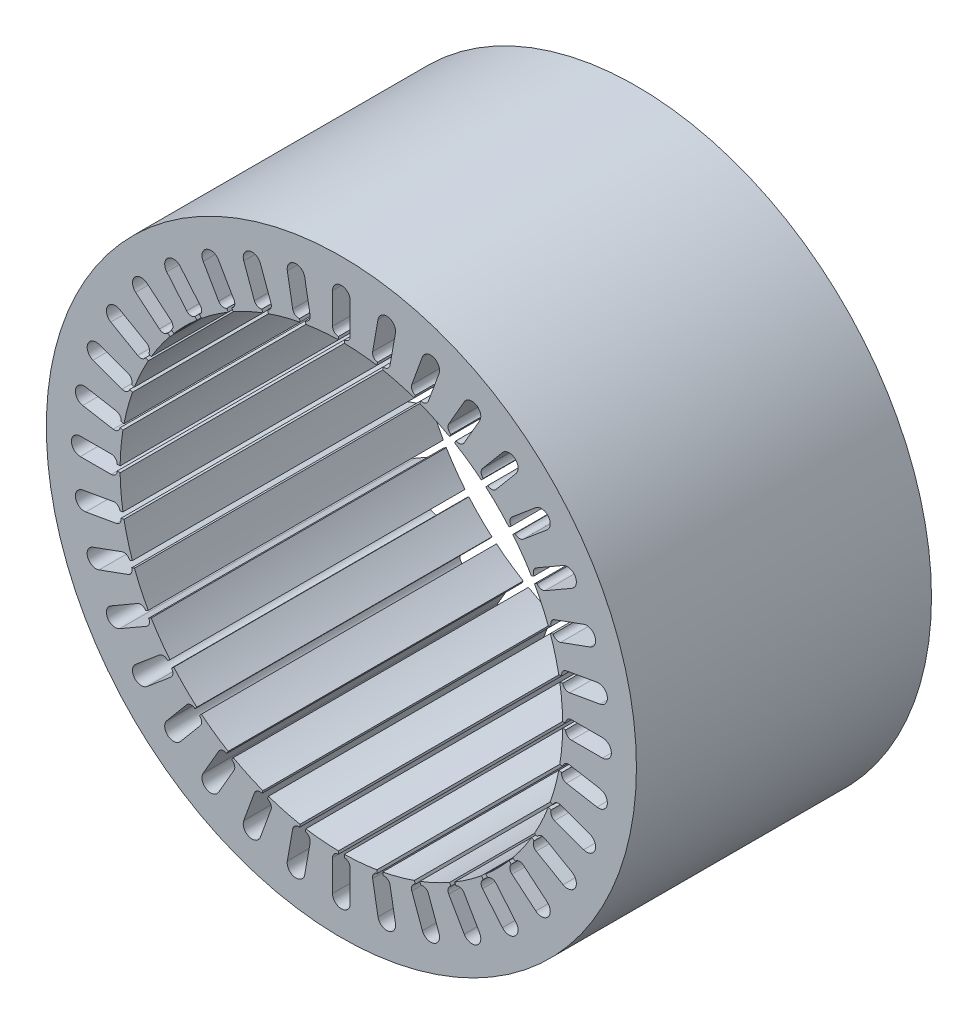
from build123d import *

# Parameters (mm, degrees)
SKETCH1_R           = 100
BOSS_EXTRUDE1_DEPTH = 100


with BuildPart() as part:
    # Sketch1 → Boss-Extrude1 (new body)
    with BuildSketch(Plane.XY):
        Circle(SKETCH1_R)
        with BuildLine():
            Line((74.027663977, -12.037647866), (75.01247173, -12.211296044))
            ThreePointArc((75.01247173, -12.211296044), (75.834934363, -10.92028831), (77.329383591, -10.588976893))
            Line((77.329383591, -10.588976893), (87.669864998, -12.412282759))
            ThreePointArc((87.669864998, -12.412282759), (90.103343724, -15.887650551), (86.627975932, -18.321129277))
            Line((86.627975932, -18.321129277), (76.287494525, -16.497823411))
            ThreePointArc((76.287494525, -16.497823411), (74.996486792, -15.675360778), (74.665175374, -14.18091155))
            Line((74.665175374, -14.18091155), (73.680367621, -14.007263372))
            ThreePointArc((73.680367621, -14.007263372), (73.112351072, -16.720769145), (72.444436972, -19.411428383))
            ThreePointArc((72.444436972, -19.411428383), (71.677537931, -22.075564686), (70.812701806, -24.709537893))
            Line((70.812701806, -24.709537893), (71.752394427, -25.051558036))
            ThreePointArc((71.752394427, -25.051558036), (72.786543145, -23.922982749), (74.315819955, -23.856213081))
            Line((74.315819955, -23.856213081), (84.182592474, -27.447424586))
            ThreePointArc((84.182592474, -27.447424586), (85.975609906, -31.292562879), (82.130471614, -33.085580311))
            Line((82.130471614, -33.085580311), (72.263699095, -29.494368806))
            ThreePointArc((72.263699095, -29.494368806), (71.135123808, -28.460220088), (71.06835414, -26.930943278))
            Line((71.06835414, -26.930943278), (70.12866152, -26.588923135))
            ThreePointArc((70.12866152, -26.588923135), (69.098079085, -29.162569619), (67.973084028, -31.696369631))
            ThreePointArc((67.973084028, -31.696369631), (66.755213492, -34.186861096), (65.446131525, -36.630641115))
            Line((65.446131525, -36.630641115), (66.312156928, -37.130641115))
            ThreePointArc((66.312156928, -37.130641115), (67.526569646, -36.198789462), (69.044207736, -36.398590307))
            Line((69.044207736, -36.398590307), (78.137474476, -41.648590307))
            ThreePointArc((78.137474476, -41.648590307), (79.235550687, -45.746666519), (75.137474476, -46.84474273))
            Line((75.137474476, -46.84474273), (66.044207736, -41.59474273))
            ThreePointArc((66.044207736, -41.59474273), (65.112356083, -40.380330012), (65.312156928, -38.862691922))
            Line((65.312156928, -38.862691922), (64.446131525, -38.362691922))
            ThreePointArc((64.446131525, -38.362691922), (62.984296931, -40.718280172), (61.436403322, -43.018232726))
            ThreePointArc((61.436403322, -43.018232726), (59.804565672, -45.259407031), (58.091013654, -47.438740842))
            Line((58.091013654, -47.438740842), (58.857058097, -48.081528452))
            ThreePointArc((58.857058097, -48.081528452), (60.214835498, -47.374714275), (61.674722202, -47.835014785))
            Line((61.674722202, -47.835014785), (69.718188855, -54.584284687))
            ThreePointArc((69.718188855, -54.584284687), (70.087959355, -58.810780845), (65.861463197, -59.180551345))
            Line((65.861463197, -59.180551345), (57.817996544, -52.431281444))
            ThreePointArc((57.817996544, -52.431281444), (57.111182367, -51.073504043), (57.571482877, -49.613617338))
            Line((57.571482877, -49.613617338), (56.805438434, -48.970829728))
            ThreePointArc((56.805438434, -48.970829728), (54.956768786, -51.036786386), (53.033008589, -53.033008589))
            ThreePointArc((53.033008589, -53.033008589), (51.036786386, -54.956768786), (48.970829728, -56.805438434))
            Line((48.970829728, -56.805438434), (49.613617338, -57.571482877))
            ThreePointArc((49.613617338, -57.571482877), (51.073504043, -57.111182367), (52.431281444, -57.817996544))
            Line((52.431281444, -57.817996544), (59.180551345, -65.861463197))
            ThreePointArc((59.180551345, -65.861463197), (58.810780845, -70.087959355), (54.584284687, -69.718188855))
            Line((54.584284687, -69.718188855), (47.835014785, -61.674722202))
            ThreePointArc((47.835014785, -61.674722202), (47.374714275, -60.214835498), (48.081528452, -58.857058097))
            Line((48.081528452, -58.857058097), (47.438740842, -58.091013654))
            ThreePointArc((47.438740842, -58.091013654), (45.259407031, -59.804565672), (43.018232726, -61.436403322))
            ThreePointArc((43.018232726, -61.436403322), (40.718280172, -62.984296931), (38.362691922, -64.446131525))
            Line((38.362691922, -64.446131525), (38.862691922, -65.312156928))
            ThreePointArc((38.862691922, -65.312156928), (40.380330012, -65.112356083), (41.59474273, -66.044207736))
            Line((41.59474273, -66.044207736), (46.84474273, -75.137474476))
            ThreePointArc((46.84474273, -75.137474476), (45.746666519, -79.235550687), (41.648590307, -78.137474476))
            Line((41.648590307, -78.137474476), (36.398590307, -69.044207736))
            ThreePointArc((36.398590307, -69.044207736), (36.198789462, -67.526569646), (37.130641115, -66.312156928))
            Line((37.130641115, -66.312156928), (36.630641115, -65.446131525))
            ThreePointArc((36.630641115, -65.446131525), (34.186861096, -66.755213492), (31.696369631, -67.973084028))
            ThreePointArc((31.696369631, -67.973084028), (29.162569619, -69.098079085), (26.588923135, -70.12866152))
            Line((26.588923135, -70.12866152), (26.930943278, -71.06835414))
            ThreePointArc((26.930943278, -71.06835414), (28.460220088, -71.135123808), (29.494368806, -72.263699095))
            Line((29.494368806, -72.263699095), (33.085580311, -82.130471614))
            ThreePointArc((33.085580311, -82.130471614), (31.292562879, -85.975609906), (27.447424586, -84.182592474))
            Line((27.447424586, -84.182592474), (23.856213081, -74.315819955))
            ThreePointArc((23.856213081, -74.315819955), (23.922982749, -72.786543145), (25.051558036, -71.752394427))
            Line((25.051558036, -71.752394427), (24.709537893, -70.812701806))
            ThreePointArc((24.709537893, -70.812701806), (22.075564686, -71.677537931), (19.411428383, -72.444436972))
            ThreePointArc((19.411428383, -72.444436972), (16.720769145, -73.112351072), (14.007263372, -73.680367621))
            Line((14.007263372, -73.680367621), (14.18091155, -74.665175374))
            ThreePointArc((14.18091155, -74.665175374), (15.675360778, -74.996486792), (16.497823411, -76.287494525))
            Line((16.497823411, -76.287494525), (18.321129277, -86.627975932))
            ThreePointArc((18.321129277, -86.627975932), (15.887650551, -90.103343724), (12.412282759, -87.669864998))
            Line((12.412282759, -87.669864998), (10.588976893, -77.329383591))
            ThreePointArc((10.588976893, -77.329383591), (10.92028831, -75.834934363), (12.211296044, -75.01247173))
            Line((12.211296044, -75.01247173), (12.037647866, -74.027663977))
            ThreePointArc((12.037647866, -74.027663977), (9.293513413, -74.42197665), (6.536680706, -74.714602357))
            ThreePointArc((6.536680706, -74.714602357), (3.770916562, -74.905141267), (1, -74.993333037))
            Line((1, -74.993333037), (1, -75.993333037))
            ThreePointArc((1, -75.993333037), (2.414213562, -76.579119475), (3, -77.993333037))
            Line((3, -77.993333037), (3, -88.493333037))
            ThreePointArc((3, -88.493333037), (0, -91.493333037), (-3, -88.493333037))
            Line((-3, -88.493333037), (-3, -77.993333037))
            ThreePointArc((-3, -77.993333037), (-2.414213562, -76.579119475), (-1, -75.993333037))
            Line((-1, -75.993333037), (-1, -74.993333037))
            ThreePointArc((-1, -74.993333037), (-3.770916562, -74.905141267), (-6.536680706, -74.714602357))
            ThreePointArc((-6.536680706, -74.714602357), (-9.293513413, -74.42197665), (-12.037647866, -74.027663977))
            Line((-12.037647866, -74.027663977), (-12.211296044, -75.01247173))
            ThreePointArc((-12.211296044, -75.01247173), (-10.92028831, -75.834934363), (-10.588976893, -77.329383591))
            Line((-10.588976893, -77.329383591), (-12.412282759, -87.669864998))
            ThreePointArc((-12.412282759, -87.669864998), (-15.887650551, -90.103343724), (-18.321129277, -86.627975932))
            Line((-18.321129277, -86.627975932), (-16.497823411, -76.287494525))
            ThreePointArc((-16.497823411, -76.287494525), (-15.675360778, -74.996486792), (-14.18091155, -74.665175374))
            Line((-14.18091155, -74.665175374), (-14.007263372, -73.680367621))
            ThreePointArc((-14.007263372, -73.680367621), (-16.720769145, -73.112351072), (-19.411428383, -72.444436972))
            ThreePointArc((-19.411428383, -72.444436972), (-22.075564686, -71.677537931), (-24.709537893, -70.812701806))
            Line((-24.709537893, -70.812701806), (-25.051558036, -71.752394427))
            ThreePointArc((-25.051558036, -71.752394427), (-23.922982749, -72.786543145), (-23.856213081, -74.315819955))
            Line((-23.856213081, -74.315819955), (-27.447424586, -84.182592474))
            ThreePointArc((-27.447424586, -84.182592474), (-31.292562879, -85.975609906), (-33.085580311, -82.130471614))
            Line((-33.085580311, -82.130471614), (-29.494368806, -72.263699095))
            ThreePointArc((-29.494368806, -72.263699095), (-28.460220088, -71.135123808), (-26.930943278, -71.06835414))
            Line((-26.930943278, -71.06835414), (-26.588923135, -70.12866152))
            ThreePointArc((-26.588923135, -70.12866152), (-29.162569619, -69.098079085), (-31.696369631, -67.973084028))
            ThreePointArc((-31.696369631, -67.973084028), (-34.186861096, -66.755213492), (-36.630641115, -65.446131525))
            Line((-36.630641115, -65.446131525), (-37.130641115, -66.312156928))
            ThreePointArc((-37.130641115, -66.312156928), (-36.198789462, -67.526569646), (-36.398590307, -69.044207736))
            Line((-36.398590307, -69.044207736), (-41.648590307, -78.137474476))
            ThreePointArc((-41.648590307, -78.137474476), (-45.746666519, -79.235550687), (-46.84474273, -75.137474476))
            Line((-46.84474273, -75.137474476), (-41.59474273, -66.044207736))
            ThreePointArc((-41.59474273, -66.044207736), (-40.380330012, -65.112356083), (-38.862691922, -65.312156928))
            Line((-38.862691922, -65.312156928), (-38.362691922, -64.446131525))
            ThreePointArc((-38.362691922, -64.446131525), (-40.718280172, -62.984296931), (-43.018232726, -61.436403322))
            ThreePointArc((-43.018232726, -61.436403322), (-45.259407031, -59.804565672), (-47.438740842, -58.091013654))
            Line((-47.438740842, -58.091013654), (-48.081528452, -58.857058097))
            ThreePointArc((-48.081528452, -58.857058097), (-47.374714275, -60.214835498), (-47.835014785, -61.674722202))
            Line((-47.835014785, -61.674722202), (-54.584284687, -69.718188855))
            ThreePointArc((-54.584284687, -69.718188855), (-58.810780845, -70.087959355), (-59.180551345, -65.861463197))
            Line((-59.180551345, -65.861463197), (-52.431281444, -57.817996544))
            ThreePointArc((-52.431281444, -57.817996544), (-51.073504043, -57.111182367), (-49.613617338, -57.571482877))
            Line((-49.613617338, -57.571482877), (-48.970829728, -56.805438434))
            ThreePointArc((-48.970829728, -56.805438434), (-51.036786386, -54.956768786), (-53.033008589, -53.033008589))
            ThreePointArc((-53.033008589, -53.033008589), (-54.956768786, -51.036786386), (-56.805438434, -48.970829728))
            Line((-56.805438434, -48.970829728), (-57.571482877, -49.613617338))
            ThreePointArc((-57.571482877, -49.613617338), (-57.111182367, -51.073504043), (-57.817996544, -52.431281444))
            Line((-57.817996544, -52.431281444), (-65.861463197, -59.180551345))
            ThreePointArc((-65.861463197, -59.180551345), (-70.087959355, -58.810780845), (-69.718188855, -54.584284687))
            Line((-69.718188855, -54.584284687), (-61.674722202, -47.835014785))
            ThreePointArc((-61.674722202, -47.835014785), (-60.214835498, -47.374714275), (-58.857058097, -48.081528452))
            Line((-58.857058097, -48.081528452), (-58.091013654, -47.438740842))
            ThreePointArc((-58.091013654, -47.438740842), (-59.804565672, -45.259407031), (-61.436403322, -43.018232726))
            ThreePointArc((-61.436403322, -43.018232726), (-62.984296931, -40.718280172), (-64.446131525, -38.362691922))
            Line((-64.446131525, -38.362691922), (-65.312156928, -38.862691922))
            ThreePointArc((-65.312156928, -38.862691922), (-65.112356083, -40.380330012), (-66.044207736, -41.59474273))
            Line((-66.044207736, -41.59474273), (-75.137474476, -46.84474273))
            ThreePointArc((-75.137474476, -46.84474273), (-79.235550687, -45.746666519), (-78.137474476, -41.648590307))
            Line((-78.137474476, -41.648590307), (-69.044207736, -36.398590307))
            ThreePointArc((-69.044207736, -36.398590307), (-67.526569646, -36.198789462), (-66.312156928, -37.130641115))
            Line((-66.312156928, -37.130641115), (-65.446131525, -36.630641115))
            ThreePointArc((-65.446131525, -36.630641115), (-66.755213492, -34.186861096), (-67.973084028, -31.696369631))
            ThreePointArc((-67.973084028, -31.696369631), (-69.098079085, -29.162569619), (-70.12866152, -26.588923135))
            Line((-70.12866152, -26.588923135), (-71.06835414, -26.930943278))
            ThreePointArc((-71.06835414, -26.930943278), (-71.135123808, -28.460220088), (-72.263699095, -29.494368806))
            Line((-72.263699095, -29.494368806), (-82.130471614, -33.085580311))
            ThreePointArc((-82.130471614, -33.085580311), (-85.975609906, -31.292562879), (-84.182592474, -27.447424586))
            Line((-84.182592474, -27.447424586), (-74.315819955, -23.856213081))
            ThreePointArc((-74.315819955, -23.856213081), (-72.786543145, -23.922982749), (-71.752394427, -25.051558036))
            Line((-71.752394427, -25.051558036), (-70.812701806, -24.709537893))
            ThreePointArc((-70.812701806, -24.709537893), (-71.677537931, -22.075564686), (-72.444436972, -19.411428383))
            ThreePointArc((-72.444436972, -19.411428383), (-73.112351072, -16.720769145), (-73.680367621, -14.007263372))
            Line((-73.680367621, -14.007263372), (-74.665175374, -14.18091155))
            ThreePointArc((-74.665175374, -14.18091155), (-74.996486792, -15.675360778), (-76.287494525, -16.497823411))
            Line((-76.287494525, -16.497823411), (-86.627975932, -18.321129277))
            ThreePointArc((-86.627975932, -18.321129277), (-90.103343724, -15.887650551), (-87.669864998, -12.412282759))
            Line((-87.669864998, -12.412282759), (-77.329383591, -10.588976893))
            ThreePointArc((-77.329383591, -10.588976893), (-75.834934363, -10.92028831), (-75.01247173, -12.211296044))
            Line((-75.01247173, -12.211296044), (-74.027663977, -12.037647866))
            ThreePointArc((-74.027663977, -12.037647866), (-74.42197665, -9.293513413), (-74.714602357, -6.536680706))
            ThreePointArc((-74.714602357, -6.536680706), (-74.905141267, -3.770916562), (-74.993333037, -1))
            Line((-74.993333037, -1), (-75.993333037, -1))
            ThreePointArc((-75.993333037, -1), (-76.579119475, -2.414213562), (-77.993333037, -3))
            Line((-77.993333037, -3), (-88.493333037, -3))
            ThreePointArc((-88.493333037, -3), (-91.493333037, 0), (-88.493333037, 3))
            Line((-88.493333037, 3), (-77.993333037, 3))
            ThreePointArc((-77.993333037, 3), (-76.579119475, 2.414213562), (-75.993333037, 1))
            Line((-75.993333037, 1), (-74.993333037, 1))
            ThreePointArc((-74.993333037, 1), (-74.905141267, 3.770916562), (-74.714602357, 6.536680706))
            ThreePointArc((-74.714602357, 6.536680706), (-74.42197665, 9.293513413), (-74.027663977, 12.037647866))
            Line((-74.027663977, 12.037647866), (-75.01247173, 12.211296044))
            ThreePointArc((-75.01247173, 12.211296044), (-75.834934363, 10.92028831), (-77.329383591, 10.588976893))
            Line((-77.329383591, 10.588976893), (-87.669864998, 12.412282759))
            ThreePointArc((-87.669864998, 12.412282759), (-90.103343724, 15.887650551), (-86.627975932, 18.321129277))
            Line((-86.627975932, 18.321129277), (-76.287494525, 16.497823411))
            ThreePointArc((-76.287494525, 16.497823411), (-74.996486792, 15.675360778), (-74.665175374, 14.18091155))
            Line((-74.665175374, 14.18091155), (-73.680367621, 14.007263372))
            ThreePointArc((-73.680367621, 14.007263372), (-73.112351072, 16.720769145), (-72.444436972, 19.411428383))
            ThreePointArc((-72.444436972, 19.411428383), (-71.677537931, 22.075564686), (-70.812701806, 24.709537893))
            Line((-70.812701806, 24.709537893), (-71.752394427, 25.051558036))
            ThreePointArc((-71.752394427, 25.051558036), (-72.786543145, 23.922982749), (-74.315819955, 23.856213081))
            Line((-74.315819955, 23.856213081), (-84.182592474, 27.447424586))
            ThreePointArc((-84.182592474, 27.447424586), (-85.975609906, 31.292562879), (-82.130471614, 33.085580311))
            Line((-82.130471614, 33.085580311), (-72.263699095, 29.494368806))
            ThreePointArc((-72.263699095, 29.494368806), (-71.135123808, 28.460220088), (-71.06835414, 26.930943278))
            Line((-71.06835414, 26.930943278), (-70.12866152, 26.588923135))
            ThreePointArc((-70.12866152, 26.588923135), (-69.098079085, 29.162569619), (-67.973084028, 31.696369631))
            ThreePointArc((-67.973084028, 31.696369631), (-66.755213492, 34.186861096), (-65.446131525, 36.630641115))
            Line((-65.446131525, 36.630641115), (-66.312156928, 37.130641115))
            ThreePointArc((-66.312156928, 37.130641115), (-67.526569646, 36.198789462), (-69.044207736, 36.398590307))
            Line((-69.044207736, 36.398590307), (-78.137474476, 41.648590307))
            ThreePointArc((-78.137474476, 41.648590307), (-79.235550687, 45.746666519), (-75.137474476, 46.84474273))
            Line((-75.137474476, 46.84474273), (-66.044207736, 41.59474273))
            ThreePointArc((-66.044207736, 41.59474273), (-65.112356083, 40.380330012), (-65.312156928, 38.862691922))
            Line((-65.312156928, 38.862691922), (-64.446131525, 38.362691922))
            ThreePointArc((-64.446131525, 38.362691922), (-62.984296931, 40.718280172), (-61.436403322, 43.018232726))
            ThreePointArc((-61.436403322, 43.018232726), (-59.804565672, 45.259407031), (-58.091013654, 47.438740842))
            Line((-58.091013654, 47.438740842), (-58.857058097, 48.081528452))
            ThreePointArc((-58.857058097, 48.081528452), (-60.214835498, 47.374714275), (-61.674722202, 47.835014785))
            Line((-61.674722202, 47.835014785), (-69.718188855, 54.584284687))
            ThreePointArc((-69.718188855, 54.584284687), (-70.087959355, 58.810780845), (-65.861463197, 59.180551345))
            Line((-65.861463197, 59.180551345), (-57.817996544, 52.431281444))
            ThreePointArc((-57.817996544, 52.431281444), (-57.111182367, 51.073504043), (-57.571482877, 49.613617338))
            Line((-57.571482877, 49.613617338), (-56.805438434, 48.970829728))
            ThreePointArc((-56.805438434, 48.970829728), (-54.956768786, 51.036786386), (-53.033008589, 53.033008589))
            ThreePointArc((-53.033008589, 53.033008589), (-51.036786386, 54.956768786), (-48.970829728, 56.805438434))
            Line((-48.970829728, 56.805438434), (-49.613617338, 57.571482877))
            ThreePointArc((-49.613617338, 57.571482877), (-51.073504043, 57.111182367), (-52.431281444, 57.817996544))
            Line((-52.431281444, 57.817996544), (-59.180551345, 65.861463197))
            ThreePointArc((-59.180551345, 65.861463197), (-58.810780845, 70.087959355), (-54.584284687, 69.718188855))
            Line((-54.584284687, 69.718188855), (-47.835014785, 61.674722202))
            ThreePointArc((-47.835014785, 61.674722202), (-47.374714275, 60.214835498), (-48.081528452, 58.857058097))
            Line((-48.081528452, 58.857058097), (-47.438740842, 58.091013654))
            ThreePointArc((-47.438740842, 58.091013654), (-45.259407031, 59.804565672), (-43.018232726, 61.436403322))
            ThreePointArc((-43.018232726, 61.436403322), (-40.718280172, 62.984296931), (-38.362691922, 64.446131525))
            Line((-38.362691922, 64.446131525), (-38.862691922, 65.312156928))
            ThreePointArc((-38.862691922, 65.312156928), (-40.380330012, 65.112356083), (-41.59474273, 66.044207736))
            Line((-41.59474273, 66.044207736), (-46.84474273, 75.137474476))
            ThreePointArc((-46.84474273, 75.137474476), (-45.746666519, 79.235550687), (-41.648590307, 78.137474476))
            Line((-41.648590307, 78.137474476), (-36.398590307, 69.044207736))
            ThreePointArc((-36.398590307, 69.044207736), (-36.198789462, 67.526569646), (-37.130641115, 66.312156928))
            Line((-37.130641115, 66.312156928), (-36.630641115, 65.446131525))
            ThreePointArc((-36.630641115, 65.446131525), (-34.186861096, 66.755213492), (-31.696369631, 67.973084028))
            ThreePointArc((-31.696369631, 67.973084028), (-29.162569619, 69.098079085), (-26.588923135, 70.12866152))
            Line((-26.588923135, 70.12866152), (-26.930943278, 71.06835414))
            ThreePointArc((-26.930943278, 71.06835414), (-28.460220088, 71.135123808), (-29.494368806, 72.263699095))
            Line((-29.494368806, 72.263699095), (-33.085580311, 82.130471614))
            ThreePointArc((-33.085580311, 82.130471614), (-31.292562879, 85.975609906), (-27.447424586, 84.182592474))
            Line((-27.447424586, 84.182592474), (-23.856213081, 74.315819955))
            ThreePointArc((-23.856213081, 74.315819955), (-23.922982749, 72.786543145), (-25.051558036, 71.752394427))
            Line((-25.051558036, 71.752394427), (-24.709537893, 70.812701806))
            ThreePointArc((-24.709537893, 70.812701806), (-22.075564686, 71.677537931), (-19.411428383, 72.444436972))
            ThreePointArc((-19.411428383, 72.444436972), (-16.720769145, 73.112351072), (-14.007263372, 73.680367621))
            Line((-14.007263372, 73.680367621), (-14.18091155, 74.665175374))
            ThreePointArc((-14.18091155, 74.665175374), (-15.675360778, 74.996486792), (-16.497823411, 76.287494525))
            Line((-16.497823411, 76.287494525), (-18.321129277, 86.627975932))
            ThreePointArc((-18.321129277, 86.627975932), (-15.887650551, 90.103343724), (-12.412282759, 87.669864998))
            Line((-12.412282759, 87.669864998), (-10.588976893, 77.329383591))
            ThreePointArc((-10.588976893, 77.329383591), (-10.92028831, 75.834934363), (-12.211296044, 75.01247173))
            Line((-12.211296044, 75.01247173), (-12.037647866, 74.027663977))
            ThreePointArc((-12.037647866, 74.027663977), (-9.293513413, 74.42197665), (-6.536680706, 74.714602357))
            ThreePointArc((-6.536680706, 74.714602357), (-3.770916562, 74.905141267), (-1, 74.993333037))
            Line((-1, 74.993333037), (-1, 75.993333037))
            ThreePointArc((-1, 75.993333037), (-2.414213562, 76.579119475), (-3, 77.993333037))
            Line((-3, 77.993333037), (-3, 88.493333037))
            ThreePointArc((-3, 88.493333037), (0, 91.493333037), (3, 88.493333037))
            Line((3, 88.493333037), (3, 77.993333037))
            ThreePointArc((3, 77.993333037), (2.414213562, 76.579119475), (1, 75.993333037))
            Line((1, 75.993333037), (1, 74.993333037))
            ThreePointArc((1, 74.993333037), (3.770916562, 74.905141267), (6.536680706, 74.714602357))
            ThreePointArc((6.536680706, 74.714602357), (9.293513413, 74.42197665), (12.037647866, 74.027663977))
            Line((12.037647866, 74.027663977), (12.211296044, 75.01247173))
            ThreePointArc((12.211296044, 75.01247173), (10.92028831, 75.834934363), (10.588976893, 77.329383591))
            Line((10.588976893, 77.329383591), (12.412282759, 87.669864998))
            ThreePointArc((12.412282759, 87.669864998), (15.887650551, 90.103343724), (18.321129277, 86.627975932))
            Line((18.321129277, 86.627975932), (16.497823411, 76.287494525))
            ThreePointArc((16.497823411, 76.287494525), (15.675360778, 74.996486792), (14.18091155, 74.665175374))
            Line((14.18091155, 74.665175374), (14.007263372, 73.680367621))
            ThreePointArc((14.007263372, 73.680367621), (16.720769145, 73.112351072), (19.411428383, 72.444436972))
            ThreePointArc((19.411428383, 72.444436972), (22.075564686, 71.677537931), (24.709537893, 70.812701806))
            Line((24.709537893, 70.812701806), (25.051558036, 71.752394427))
            ThreePointArc((25.051558036, 71.752394427), (23.922982749, 72.786543145), (23.856213081, 74.315819955))
            Line((23.856213081, 74.315819955), (27.447424586, 84.182592474))
            ThreePointArc((27.447424586, 84.182592474), (31.292562879, 85.975609906), (33.085580311, 82.130471614))
            Line((33.085580311, 82.130471614), (29.494368806, 72.263699095))
            ThreePointArc((29.494368806, 72.263699095), (28.460220088, 71.135123808), (26.930943278, 71.06835414))
            Line((26.930943278, 71.06835414), (26.588923135, 70.12866152))
            ThreePointArc((26.588923135, 70.12866152), (29.162569619, 69.098079085), (31.696369631, 67.973084028))
            ThreePointArc((31.696369631, 67.973084028), (34.186861096, 66.755213492), (36.630641115, 65.446131525))
            Line((36.630641115, 65.446131525), (37.130641115, 66.312156928))
            ThreePointArc((37.130641115, 66.312156928), (36.198789462, 67.526569646), (36.398590307, 69.044207736))
            Line((36.398590307, 69.044207736), (41.648590307, 78.137474476))
            ThreePointArc((41.648590307, 78.137474476), (45.746666519, 79.235550687), (46.84474273, 75.137474476))
            Line((46.84474273, 75.137474476), (41.59474273, 66.044207736))
            ThreePointArc((41.59474273, 66.044207736), (40.380330012, 65.112356083), (38.862691922, 65.312156928))
            Line((38.862691922, 65.312156928), (38.362691922, 64.446131525))
            ThreePointArc((38.362691922, 64.446131525), (40.718280172, 62.984296931), (43.018232726, 61.436403322))
            ThreePointArc((43.018232726, 61.436403322), (45.259407031, 59.804565672), (47.438740842, 58.091013654))
            Line((47.438740842, 58.091013654), (48.081528452, 58.857058097))
            ThreePointArc((48.081528452, 58.857058097), (47.374714275, 60.214835498), (47.835014785, 61.674722202))
            Line((47.835014785, 61.674722202), (54.584284687, 69.718188855))
            ThreePointArc((54.584284687, 69.718188855), (58.810780845, 70.087959355), (59.180551345, 65.861463197))
            Line((59.180551345, 65.861463197), (52.431281444, 57.817996544))
            ThreePointArc((52.431281444, 57.817996544), (51.073504043, 57.111182367), (49.613617338, 57.571482877))
            Line((49.613617338, 57.571482877), (48.970829728, 56.805438434))
            ThreePointArc((48.970829728, 56.805438434), (51.036786386, 54.956768786), (53.033008589, 53.033008589))
            ThreePointArc((53.033008589, 53.033008589), (54.956768786, 51.036786386), (56.805438434, 48.970829728))
            Line((56.805438434, 48.970829728), (57.571482877, 49.613617338))
            ThreePointArc((57.571482877, 49.613617338), (57.111182367, 51.073504043), (57.817996544, 52.431281444))
            Line((57.817996544, 52.431281444), (65.861463197, 59.180551345))
            ThreePointArc((65.861463197, 59.180551345), (70.087959355, 58.810780845), (69.718188855, 54.584284687))
            Line((69.718188855, 54.584284687), (61.674722202, 47.835014785))
            ThreePointArc((61.674722202, 47.835014785), (60.214835498, 47.374714275), (58.857058097, 48.081528452))
            Line((58.857058097, 48.081528452), (58.091013654, 47.438740842))
            ThreePointArc((58.091013654, 47.438740842), (59.804565672, 45.259407031), (61.436403322, 43.018232726))
            ThreePointArc((61.436403322, 43.018232726), (62.984296931, 40.718280172), (64.446131525, 38.362691922))
            Line((64.446131525, 38.362691922), (65.312156928, 38.862691922))
            ThreePointArc((65.312156928, 38.862691922), (65.112356083, 40.380330012), (66.044207736, 41.59474273))
            Line((66.044207736, 41.59474273), (75.137474476, 46.84474273))
            ThreePointArc((75.137474476, 46.84474273), (79.235550687, 45.746666519), (78.137474476, 41.648590307))
            Line((78.137474476, 41.648590307), (69.044207736, 36.398590307))
            ThreePointArc((69.044207736, 36.398590307), (67.526569646, 36.198789462), (66.312156928, 37.130641115))
            Line((66.312156928, 37.130641115), (65.446131525, 36.630641115))
            ThreePointArc((65.446131525, 36.630641115), (66.755213492, 34.186861096), (67.973084028, 31.696369631))
            ThreePointArc((67.973084028, 31.696369631), (69.098079085, 29.162569619), (70.12866152, 26.588923135))
            Line((70.12866152, 26.588923135), (71.06835414, 26.930943278))
            ThreePointArc((71.06835414, 26.930943278), (71.135123808, 28.460220088), (72.263699095, 29.494368806))
            Line((72.263699095, 29.494368806), (82.130471614, 33.085580311))
            ThreePointArc((82.130471614, 33.085580311), (85.975609906, 31.292562879), (84.182592474, 27.447424586))
            Line((84.182592474, 27.447424586), (74.315819955, 23.856213081))
            ThreePointArc((74.315819955, 23.856213081), (72.786543145, 23.922982749), (71.752394427, 25.051558036))
            Line((71.752394427, 25.051558036), (70.812701806, 24.709537893))
            ThreePointArc((70.812701806, 24.709537893), (71.677537931, 22.075564686), (72.444436972, 19.411428383))
            ThreePointArc((72.444436972, 19.411428383), (73.112351072, 16.720769145), (73.680367621, 14.007263372))
            Line((73.680367621, 14.007263372), (74.665175374, 14.18091155))
            ThreePointArc((74.665175374, 14.18091155), (74.996486792, 15.675360778), (76.287494525, 16.497823411))
            Line((76.287494525, 16.497823411), (86.627975932, 18.321129277))
            ThreePointArc((86.627975932, 18.321129277), (90.103343724, 15.887650551), (87.669864998, 12.412282759))
            Line((87.669864998, 12.412282759), (77.329383591, 10.588976893))
            ThreePointArc((77.329383591, 10.588976893), (75.834934363, 10.92028831), (75.01247173, 12.211296044))
            Line((75.01247173, 12.211296044), (74.027663977, 12.037647866))
            ThreePointArc((74.027663977, 12.037647866), (74.42197665, 9.293513413), (74.714602357, 6.536680706))
            ThreePointArc((74.714602357, 6.536680706), (74.905141267, 3.770916562), (74.993333037, 1))
            Line((74.993333037, 1), (75.993333037, 1))
            ThreePointArc((75.993333037, 1), (76.579119475, 2.414213562), (77.993333037, 3))
            Line((77.993333037, 3), (88.493333037, 3))
            ThreePointArc((88.493333037, 3), (91.493333037, 0), (88.493333037, -3))
            Line((88.493333037, -3), (77.993333037, -3))
            ThreePointArc((77.993333037, -3), (76.579119475, -2.414213562), (75.993333037, -1))
            Line((75.993333037, -1), (74.993333037, -1))
            ThreePointArc((74.993333037, -1), (74.905141267, -3.770916562), (74.714602357, -6.536680706))
            ThreePointArc((74.714602357, -6.536680706), (74.42197665, -9.293513413), (74.027663977, -12.037647866))
        make_face(mode=Mode.SUBTRACT)
    extrude(amount=BOSS_EXTRUDE1_DEPTH)


solid = part.part
